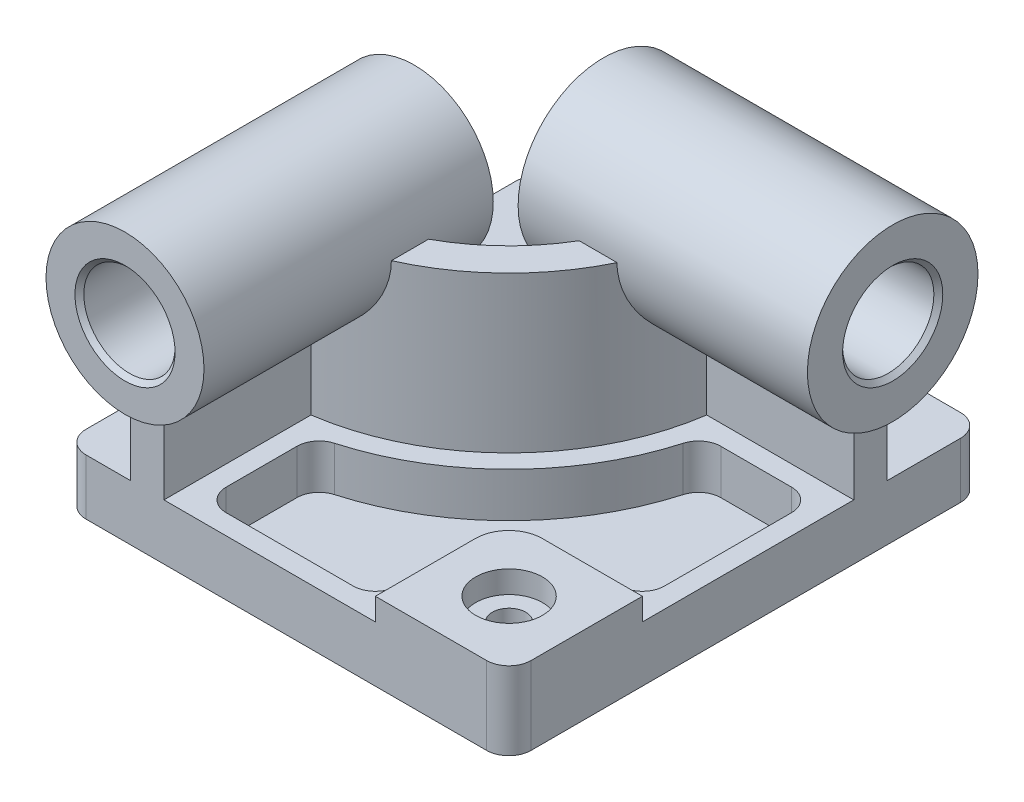
from build123d import *

# Parameters (mm, degrees)
ESQUISSE1_W                                        = 200
ESQUISSE1_H                                        = 213
BOSS_EXTRU_1_DEPTH                                 = 25
ESQUISSE2_W                                        = 60
ESQUISSE2_H                                        = 60
BOSS_EXTRU_2_DEPTH                                 = 10
CONG_1_R                                           = 10
CONG_2_R                                           = 15
CHAMBRAGE_POUR_VIS_T_TE_HEXAGONALE_M86_D           = 15
CHAMBRAGE_POUR_VIS_T_TE_HEXAGONALE_M86_CBORE_D     = 30
CHAMBRAGE_POUR_VIS_T_TE_HEXAGONALE_M86_CBORE_DEPTH = 10
BOSS_EXTRU_3_DEPTH                                 = 70
ENL_V_MAT_EXTRU_1_DEPTH                            = 20
BOSS_EXTRU_5_START                                 = 10
ESQUISSE11_R                                       = 35.5
ESQUISSE11_R_2                                     = 20.5
BOSS_EXTRU_5_DEPTH                                 = 130
ESQUISSE12_R                                       = 20.5
ENL_V_MAT_EXTRU_2_DEPTH                            = 130
BOSS_EXTRU_6_START                                 = 10
ESQUISSE13_R                                       = 38.333333333
ESQUISSE13_R_2                                     = 20.5
BOSS_EXTRU_6_DEPTH                                 = 130
ESQUISSE14_R                                       = 20.5
ENL_V_MAT_EXTRU_3_DEPTH                            = 275.681684551
CHANFREIN1_SIZE                                    = 2


with BuildPart() as part:
    # Esquisse1 → Boss.-Extru.1 (new body)
    with BuildSketch(Plane(origin=(0, 0, 0), x_dir=(1, 0, 0), z_dir=(0, 1, 0))):
        Rectangle(ESQUISSE1_W, ESQUISSE1_H)
    extrude(amount=BOSS_EXTRU_1_DEPTH)

    # Esquisse2 → Boss.-Extru.2 (add)
    with BuildSketch(Plane(origin=(0, 25, 0), x_dir=(1, 0, 0), z_dir=(0, 1, 0))):
        with Locations((70, -76.5)):
            Rectangle(ESQUISSE2_W, ESQUISSE2_H)
    extrude(amount=BOSS_EXTRU_2_DEPTH)

    # Congé1
    cong_1_edges = [part.edges().sort_by_distance(p)[0] for p in [
        (100, 17.5, 106.5),
        (-100, 12.5, 106.5),
        (-100, 12.5, -106.5),
        (100, 12.5, -106.5),
    ]]
    fillet(cong_1_edges, radius=CONG_1_R)

    # Congé2
    cong_2_edges = [part.edges().sort_by_distance(p)[0] for p in [
        (40, 30, 46.5),
    ]]
    fillet(cong_2_edges, radius=CONG_2_R)

    # Chambrage pour vis à tête hexagonale M86 (through all)
    with Locations(Plane(origin=(0, 35, 0), x_dir=(1, 0, 0), z_dir=(0, 1, 0))):
        with Locations((70, -76.39263799)):
            CounterBoreHole(CHAMBRAGE_POUR_VIS_T_TE_HEXAGONALE_M86_D / 2, CHAMBRAGE_POUR_VIS_T_TE_HEXAGONALE_M86_CBORE_D / 2, CHAMBRAGE_POUR_VIS_T_TE_HEXAGONALE_M86_CBORE_DEPTH)

    # Esquisse9 → Boss.-Extru.3 (add)
    with BuildSketch(Plane(origin=(0, 25, 0), x_dir=(1, 0, 0), z_dir=(0, 1, 0))):
        with BuildLine():
            Line((-70, -106.5), (-70, -26.5))
            ThreePointArc((-70, -26.5), (-6.360389693, -0.139610307), (20, 63.5))
            Line((20, 63.5), (100, 63.5))
            Line((100, 63.5), (100, 48.5))
            Line((100, 48.5), (33.923048454, 48.5))
            ThreePointArc((33.923048454, 48.5), (4.246212025, -10.746212025), (-55, -40.423048454))
            Line((-55, -40.423048454), (-55, -106.5))
            Line((-55, -106.5), (-70, -106.5))
        make_face()
    extrude(amount=BOSS_EXTRU_3_DEPTH)

    # Esquisse10 → Enlèv. mat.-Extru.1 (cut)
    with BuildSketch(Plane(origin=(0, 25, 0), x_dir=(1, 0, 0), z_dir=(0, 1, 0))):
        with BuildLine():
            Line((-46, -55.747641486), (-46, -87.5))
            ThreePointArc((-46, -87.5), (-43.071067812, -94.571067812), (-36, -97.5))
            Line((-36, -97.5), (21, -97.5))
            ThreePointArc((21, -97.5), (28.071067812, -94.571067812), (31, -87.5))
            Line((31, -87.5), (31, -61.5))
            ThreePointArc((31, -61.5), (38.029437252, -44.529437252), (55, -37.5))
            Line((55, -37.5), (81, -37.5))
            ThreePointArc((81, -37.5), (88.071067812, -34.571067812), (91, -27.5))
            Line((91, -27.5), (91, 29.5))
            ThreePointArc((91, 29.5), (88.071067812, 36.571067812), (81, 39.5))
            Line((81, 39.5), (49.247641486, 39.5))
            ThreePointArc((49.247641486, 39.5), (43.223496519, 37.481834214), (39.630896205, 32.241935484))
            ThreePointArc((39.630896205, 32.241935484), (10.610173055, -17.110173055), (-38.741935484, -46.130896205))
            ThreePointArc((-38.741935484, -46.130896205), (-43.981834214, -49.723496519), (-46, -55.747641486))
        make_face()
    extrude(amount=-ENL_V_MAT_EXTRU_1_DEPTH, mode=Mode.SUBTRACT)

    # Esquisse11 → Boss.-Extru.5 (add)
    with BuildSketch(Plane.XY.offset(106.5).offset(BOSS_EXTRU_5_START)):
        with Locations((-62.5, 95)):
            Circle(ESQUISSE11_R)
        with Locations((-62.5, 95)):
            Circle(ESQUISSE11_R_2, mode=Mode.SUBTRACT)
    extrude(amount=-BOSS_EXTRU_5_DEPTH)

    # Esquisse12 → Enlèv. mat.-Extru.2 (cut)
    with BuildSketch(Plane.XY.offset(116.5)):
        with Locations((-62.5, 95)):
            Circle(ESQUISSE12_R)
    extrude(amount=-ENL_V_MAT_EXTRU_2_DEPTH, mode=Mode.SUBTRACT)

    # Esquisse13 → Boss.-Extru.6 (add)
    with BuildSketch(Plane(origin=(100, 0, 0), x_dir=(0, 0, -1), z_dir=(1, 0, 0)).offset(BOSS_EXTRU_6_START)):
        with Locations((56, 95)):
            Circle(ESQUISSE13_R)
        with Locations((56, 95)):
            Circle(ESQUISSE13_R_2, mode=Mode.SUBTRACT)
    extrude(amount=-BOSS_EXTRU_6_DEPTH)

    # Esquisse14 → Enlèv. mat.-Extru.3 (cut, through all)
    with BuildSketch(Plane(origin=(110, 0, 0), x_dir=(0, 0, -1), z_dir=(1, 0, 0))):
        with Locations((56, 95)):
            Circle(ESQUISSE14_R)
    extrude(amount=-ENL_V_MAT_EXTRU_3_DEPTH, mode=Mode.SUBTRACT)

    # Chanfrein1
    chanfrein1_edges = [part.edges().sort_by_distance(p)[0] for p in [
        (-83, 95, 116.5),
        (-83, 95, -13.5),
        (110, 95, -35.5),
        (-20, 95, -35.5),
    ]]
    chamfer(chanfrein1_edges, length=CHANFREIN1_SIZE)


solid = part.part
